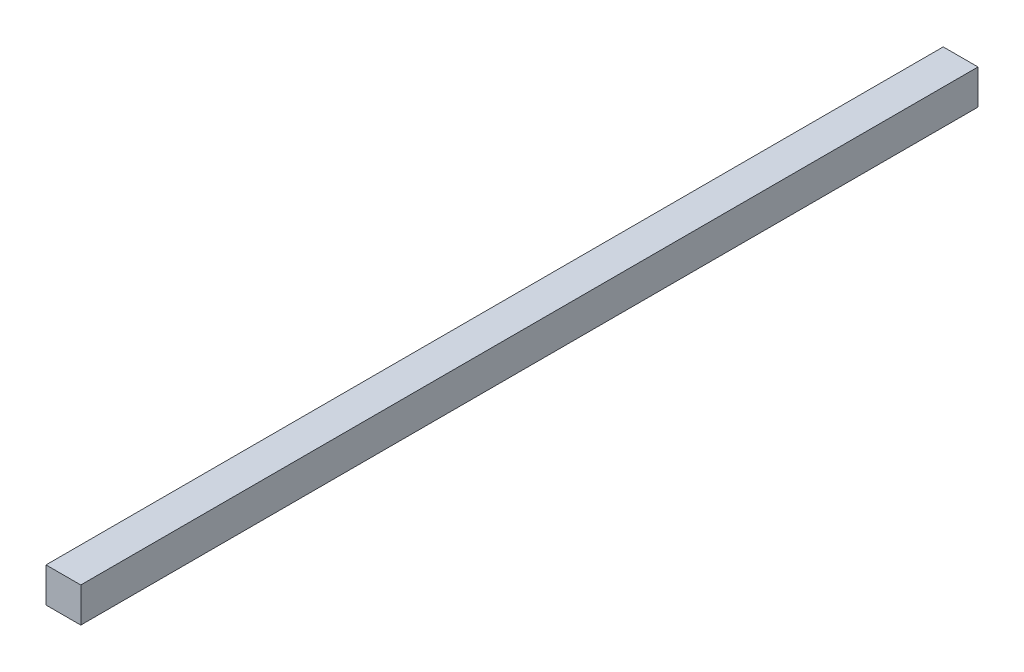
from build123d import *

# Parameters (mm, degrees)
SKETCH_1_W      = 15.5
SKETCH_1_H      = 15.5
EXTRUDE_1_DEPTH = 400


with BuildPart() as part:
    # 草图1 → 凸台-拉伸1 (new body)
    with BuildSketch(Plane.XY):
        with Locations((4.586734694, 6.010204082)):
            Rectangle(SKETCH_1_W, SKETCH_1_H)
    extrude(amount=EXTRUDE_1_DEPTH)


solid = part.part
